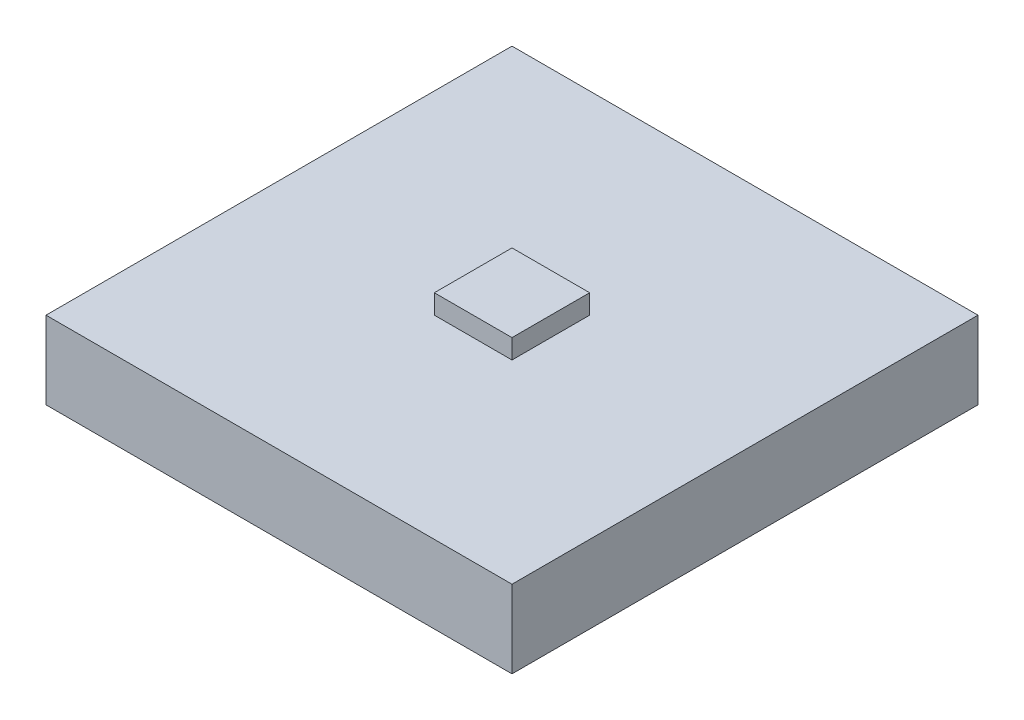
from build123d import *

# Parameters (mm, degrees)
SKETCH1_W           = 76.2
SKETCH1_H           = 76.2
BOSS_EXTRUDE1_DEPTH = 12.7
SKETCH2_W           = 12.7
SKETCH2_H           = 12.7
BOSS_EXTRUDE2_DEPTH = 3.175


with BuildPart() as part:
    # Sketch1 → Boss-Extrude1 (new body)
    with BuildSketch(Plane(origin=(0, 0, 0), x_dir=(1, 0, 0), z_dir=(0, 1, 0))):
        with Locations((38.1, 38.1)):
            Rectangle(SKETCH1_W, SKETCH1_H)
    extrude(amount=BOSS_EXTRUDE1_DEPTH)

    # Sketch2 → Boss-Extrude2 (add)
    with BuildSketch(Plane(origin=(0, 12.7, 0), x_dir=(1, 0, 0), z_dir=(0, 1, 0))):
        with Locations((38.1, 38.1)):
            Rectangle(SKETCH2_W, SKETCH2_H)
    extrude(amount=BOSS_EXTRUDE2_DEPTH)


solid = part.part
